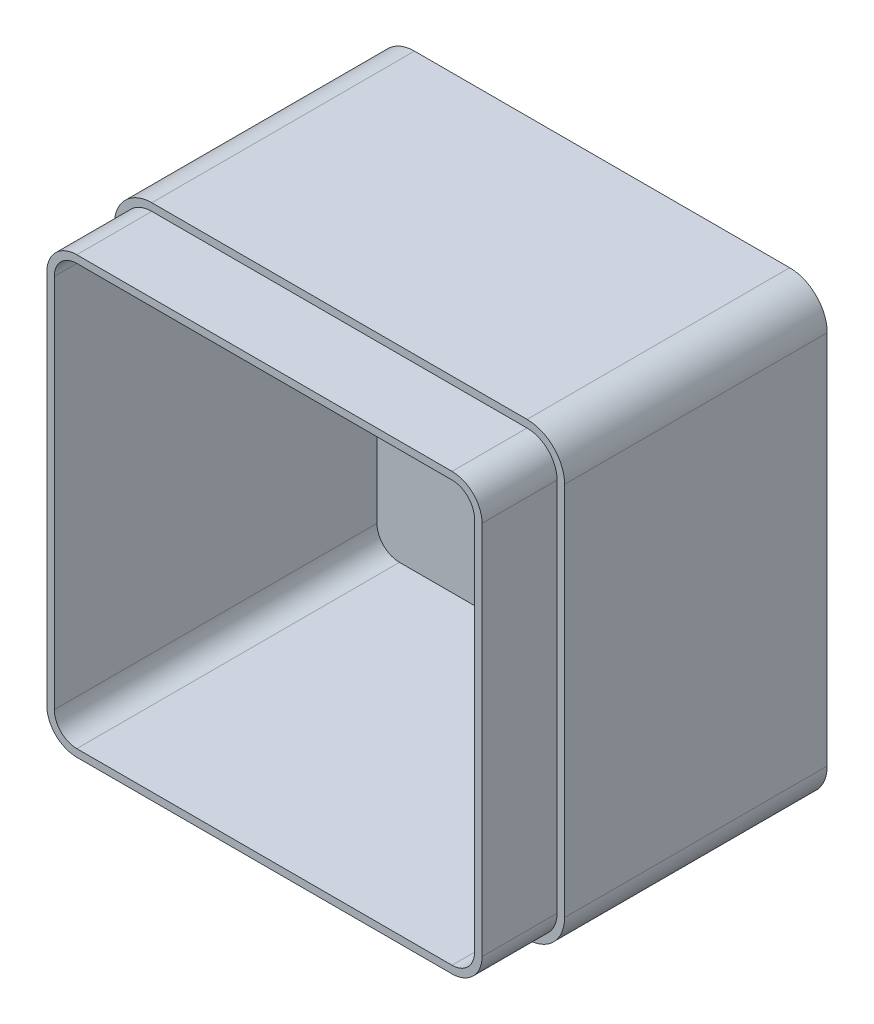
from build123d import *

# Parameters (mm, degrees)
SKETCH1_W           = 120
SKETCH1_H           = 120
BOSS_EXTRUDE1_DEPTH = 90
FILLET1_R           = 10
SHELL1_T            = -4
CUT_EXTRUDE2_DEPTH  = 20


with BuildPart() as part:
    # Sketch1 → Boss-Extrude1 (new body)
    with BuildSketch(Plane.XY):
        with Locations((60, 60)):
            Rectangle(SKETCH1_W, SKETCH1_H)
    extrude(amount=BOSS_EXTRUDE1_DEPTH)

    # Fillet1
    fillet1_edges = [part.edges().sort_by_distance(p)[0] for p in [
        (0, 120, 45),
        (120, 120, 45),
        (120, 0, 45),
        (0, 0, 45),
    ]]
    fillet(fillet1_edges, radius=FILLET1_R)

    # Shell1
    shell1_openings = [part.faces().sort_by_distance(p)[0] for p in [
        (60, 60, 90),
    ]]
    offset(amount=SHELL1_T, openings=shell1_openings, kind=Kind.INTERSECTION)

    # Sketch4 → Cut-Extrude2 (cut)
    with BuildSketch(Plane.XY.offset(90)):
        with BuildLine():
            Line((0, 110), (0, 10))
            ThreePointArc((0, 10), (2.928932188, 2.928932188), (10, 0))
            Line((10, 0), (110, 0))
            ThreePointArc((110, 0), (117.071067812, 2.928932188), (120, 10))
            Line((120, 10), (120, 110))
            ThreePointArc((120, 110), (117.071067812, 117.071067812), (110, 120))
            Line((110, 120), (10, 120))
            ThreePointArc((10, 120), (2.928932188, 117.071067812), (0, 110))
        make_face()
        with BuildLine():
            Line((2, 110), (2, 10))
            ThreePointArc((2, 10), (4.343145751, 4.343145751), (10, 2))
            Line((10, 2), (110, 2))
            ThreePointArc((110, 2), (115.656854249, 4.343145751), (118, 10))
            Line((118, 10), (118, 110))
            ThreePointArc((118, 110), (115.656854249, 115.656854249), (110, 118))
            Line((110, 118), (10, 118))
            ThreePointArc((10, 118), (4.343145751, 115.656854249), (2, 110))
        make_face(mode=Mode.SUBTRACT)
    extrude(amount=-CUT_EXTRUDE2_DEPTH, mode=Mode.SUBTRACT)


solid = part.part
